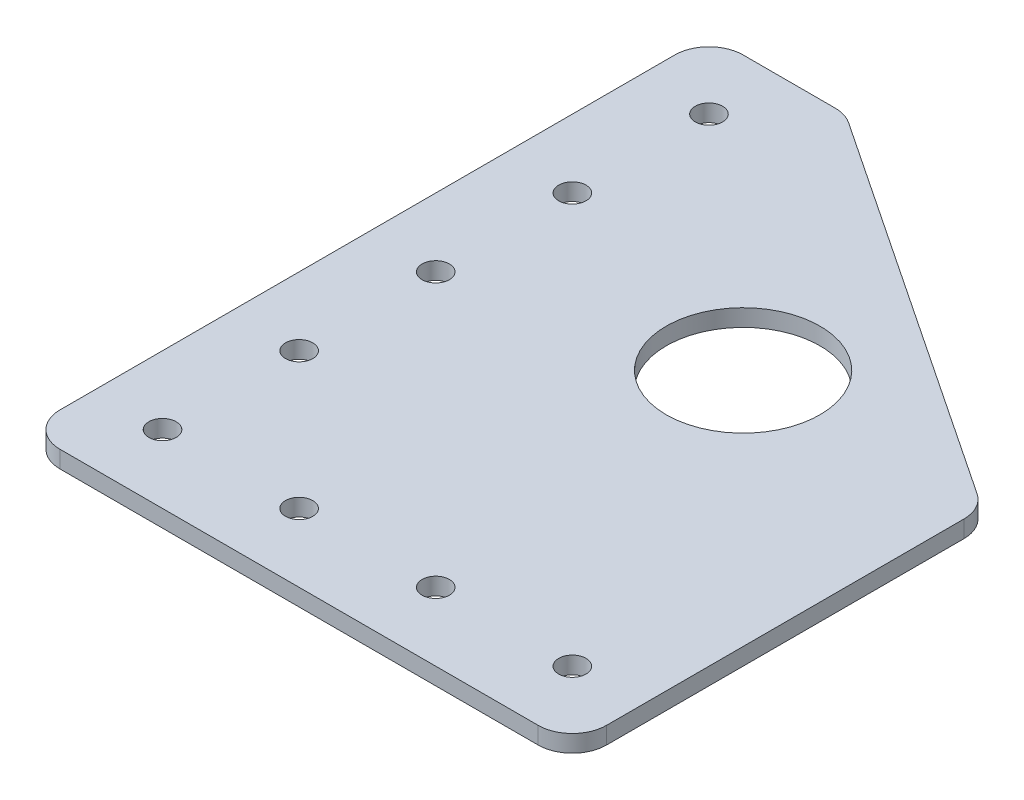
from build123d import *

# Parameters (mm, degrees)
SKETCH1_R           = 2.54
SKETCH1_R_2         = 14.2875
BOSS_EXTRUDE1_DEPTH = 3.175


with BuildPart() as part:
    # Sketch1 → Boss-Extrude1 (new body)
    with BuildSketch(Plane(origin=(0, 0, 0), x_dir=(1, 0, 0), z_dir=(0, 1, 0))):
        with BuildLine():
            Line((0, 6.35), (0, 120.65))
            ThreePointArc((0, 120.65), (1.859871939, 125.140128061), (6.35, 127))
            Line((6.35, 127), (23.4773747, 127))
            ThreePointArc((23.4773747, 127), (25.317504045, 126.727534368), (26.999720946, 125.933519369))
            Line((26.999720946, 125.933519369), (98.772346246, 78.085102503))
            ThreePointArc((98.772346246, 78.085102503), (100.848633702, 75.797880961), (101.6, 72.801583134))
            Line((101.6, 72.801583134), (101.6, 6.35))
            ThreePointArc((101.6, 6.35), (99.740128061, 1.859871939), (95.25, 0))
            Line((95.25, 0), (6.35, 0))
            ThreePointArc((6.35, 0), (1.859871939, 1.859871939), (0, 6.35))
        make_face()
        with Locations(Location((88.9, 12.7, 0), (0, 0, 270))):
            Circle(SKETCH1_R, mode=Mode.SUBTRACT)
        with Locations(Location((63.5, 12.7, 0), (0, 0, 270))):
            Circle(SKETCH1_R, mode=Mode.SUBTRACT)
        with Locations(Location((38.1, 12.7, 0), (0, 0, 270))):
            Circle(SKETCH1_R, mode=Mode.SUBTRACT)
        with Locations(Location((12.7, 12.7, 0), (0, 0, 270))):
            Circle(SKETCH1_R, mode=Mode.SUBTRACT)
        with Locations(Location((12.7, 38.1, 0), (0, 0, 270))):
            Circle(SKETCH1_R, mode=Mode.SUBTRACT)
        with Locations(Location((12.7, 63.5, 0), (0, 0, 270))):
            Circle(SKETCH1_R, mode=Mode.SUBTRACT)
        with Locations(Location((12.7, 88.9, 0), (0, 0, 270))):
            Circle(SKETCH1_R, mode=Mode.SUBTRACT)
        with Locations(Location((12.7, 114.3, 0), (0, 0, 270))):
            Circle(SKETCH1_R, mode=Mode.SUBTRACT)
        with Locations(Location((57.15, 76.2, 0), (0, 0, 270))):
            Circle(SKETCH1_R_2, mode=Mode.SUBTRACT)
    extrude(amount=BOSS_EXTRUDE1_DEPTH)


solid = part.part
